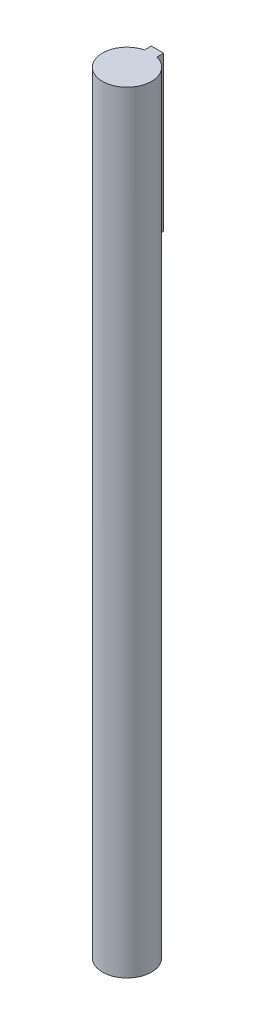
from build123d import *

# Parameters (mm, degrees)
SKETCH1_R           = 9.54
BOSS_EXTRUDE1_DEPTH = 300
BOSS_EXTRUDE2_START = -60
BOSS_EXTRUDE2_DEPTH = 60


with BuildPart() as part:
    # Sketch1 → Boss-Extrude1 (new body)
    with BuildSketch(Plane(origin=(0, 0, 0), x_dir=(1, 0, 0), z_dir=(0, 1, 0))):
        with Locations(Location((0, 0, 0), (0, 0, 270))):
            Circle(SKETCH1_R)
    extrude(amount=BOSS_EXTRUDE1_DEPTH)

    # Sketch2 → Boss-Extrude2 (add)
    with BuildSketch(Plane(origin=(0, 300, 0), x_dir=(1, 0, 0), z_dir=(0, 1, 0)).offset(BOSS_EXTRUDE2_START)):
        with BuildLine():
            Line((-2.4, 9.233179301), (-2.4, 11.87))
            Line((-2.4, 11.87), (2.4, 11.87))
            Line((2.4, 11.87), (2.4, 9.233179301))
            ThreePointArc((2.4, 9.233179301), (0, 9.54), (-2.4, 9.233179301))
        make_face()
    extrude(amount=BOSS_EXTRUDE2_DEPTH)


solid = part.part
